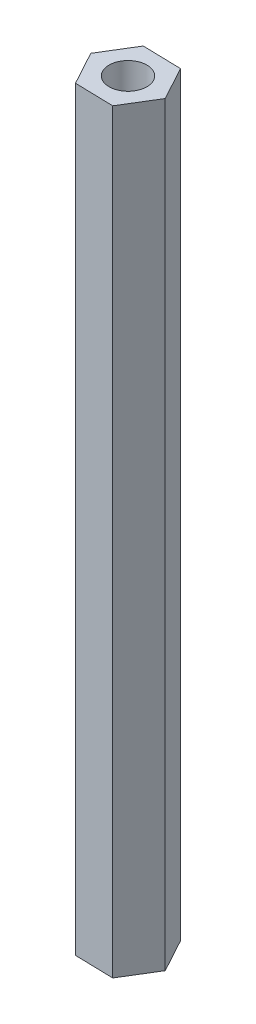
from build123d import *

# Parameters (mm, degrees)
SKETCH1_R           = 1.5
BOSS_EXTRUDE1_DEPTH = 60


with BuildPart() as part:
    # Sketch1 → Boss-Extrude1 (new body)
    with BuildSketch(Plane(origin=(0, 0, 0), x_dir=(1, 0, 0), z_dir=(0, 1, 0))):
        Polygon((1.58335974, 2.588184191), (-1.449753389, 2.665321853), (-3.033113129, 0.077137663), (-1.58335974, -2.588184191), (1.449753389, -2.665321853), (3.033113129, -0.077137663), align=None)
        with Locations(Location((0, 0, 0), (0, 0, 270))):
            Circle(SKETCH1_R, mode=Mode.SUBTRACT)
    extrude(amount=BOSS_EXTRUDE1_DEPTH)


solid = part.part
